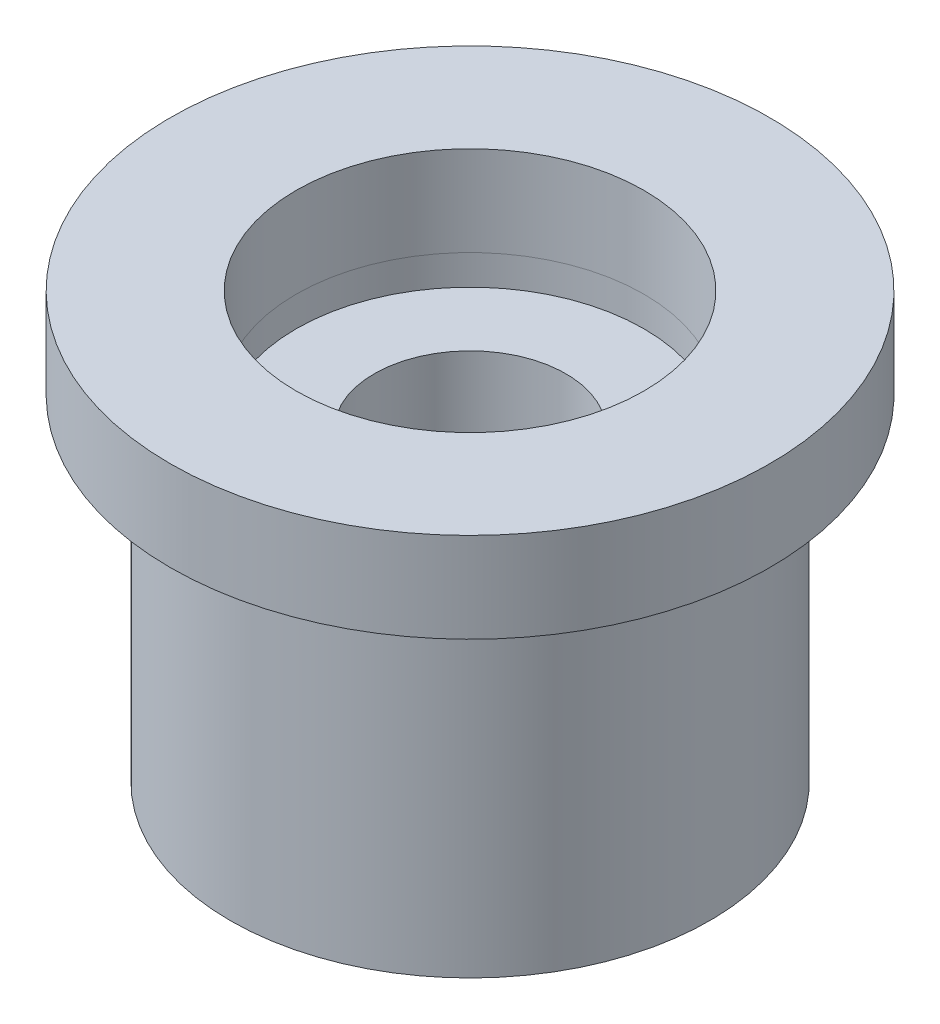
from build123d import *

# Parameters (mm, degrees)
CROQUIS2_R              = 4
SALIENTE_EXTRUIR2_DEPTH = 5.6
CROQUIS3_R              = 5
SALIENTE_EXTRUIR3_DEPTH = 1.5
CROQUIS4_R              = 2.9
CORTAR_EXTRUIR2_DEPTH   = 2
CROQUIS6_R              = 1.6
CORTAR_EXTRUIR3_DEPTH   = 9.718371408
CORTAR_EXTRUIR4_DEPTH   = 4.3


with BuildPart() as part:
    # Croquis2 → Saliente-Extruir2 (new body)
    with BuildSketch(Plane(origin=(0, 0, 0), x_dir=(1, 0, 0), z_dir=(0, 1, 0))):
        with Locations(Location((0, 0, 0), (0, 0, 270))):
            Circle(CROQUIS2_R)
    extrude(amount=SALIENTE_EXTRUIR2_DEPTH)


with BuildPart() as body_2:
    # Croquis3 → Saliente-Extruir3 (new body)
    with BuildSketch(Plane(origin=(0, 5.6, 0), x_dir=(1, 0, 0), z_dir=(0, 1, 0))):
        with Locations(Location((0, 0, 0), (0, 0, 270))):
            Circle(CROQUIS3_R)
    extrude(amount=SALIENTE_EXTRUIR3_DEPTH)


with BuildPart() as cortar_extruir2_tool:
    # Croquis4 → Cortar-Extruir2 (new body)
    with BuildSketch(Plane(origin=(0, 7.1, 0), x_dir=(1, 0, 0), z_dir=(0, 1, 0))):
        with Locations(Location((0, 0, 0), (0, 0, 270))):
            Circle(CROQUIS4_R)
    extrude(amount=-CORTAR_EXTRUIR2_DEPTH)


with BuildPart() as part_1:
    add(part.part)

    # Cortar-Extruir2: cut by cortar_extruir2_tool
    add(cortar_extruir2_tool.part, mode=Mode.SUBTRACT)

    # Croquis6 → Cortar-Extruir3 (cut, through all)
    with BuildSketch(Plane(origin=(0, 5.1, 0), x_dir=(1, 0, 0), z_dir=(0, 1, 0))):
        with Locations(Location((0, 0, 0), (0, 0, 270))):
            Circle(CROQUIS6_R)
    extrude(amount=-CORTAR_EXTRUIR3_DEPTH, mode=Mode.SUBTRACT)

    # Croquis7 → Cortar-Extruir4 (cut)
    with BuildSketch(Plane.XZ):
        with BuildLine():
            Line((2.264950331, 0.4), (3.07408523, 0.4))
            ThreePointArc((3.07408523, 0.4), (1.55, 2.684678752), (-1.190632453, 2.862235902))
            Line((-1.190632453, 2.862235902), (-0.786065004, 2.161504525))
            ThreePointArc((-0.786065004, 2.161504525), (1.15, 1.991858429), (2.264950331, 0.4))
        make_face()
        with BuildLine():
            Line((2.264950331, -0.4), (3.07408523, -0.4))
            ThreePointArc((3.07408523, -0.4), (1.55, -2.684678752), (-1.190632453, -2.862235902))
            Line((-1.190632453, -2.862235902), (-0.786065004, -2.161504525))
            ThreePointArc((-0.786065004, -2.161504525), (1.15, -1.991858429), (2.264950331, -0.4))
        make_face()
        with BuildLine():
            Line((-1.478885327, -1.761504525), (-1.883452776, -2.462235902))
            ThreePointArc((-1.883452776, -2.462235902), (-3.1, 0), (-1.883452776, 2.462235902))
            Line((-1.883452776, 2.462235902), (-1.478885327, 1.761504525))
            ThreePointArc((-1.478885327, 1.761504525), (-2.3, 0), (-1.478885327, -1.761504525))
        make_face()
    extrude(amount=-CORTAR_EXTRUIR4_DEPTH, mode=Mode.SUBTRACT)


with BuildPart() as body_2_1:
    add(body_2.part)

    # Cortar-Extruir2: cut by cortar_extruir2_tool
    add(cortar_extruir2_tool.part, mode=Mode.SUBTRACT)


solid = Compound([part_1.part, body_2_1.part])
